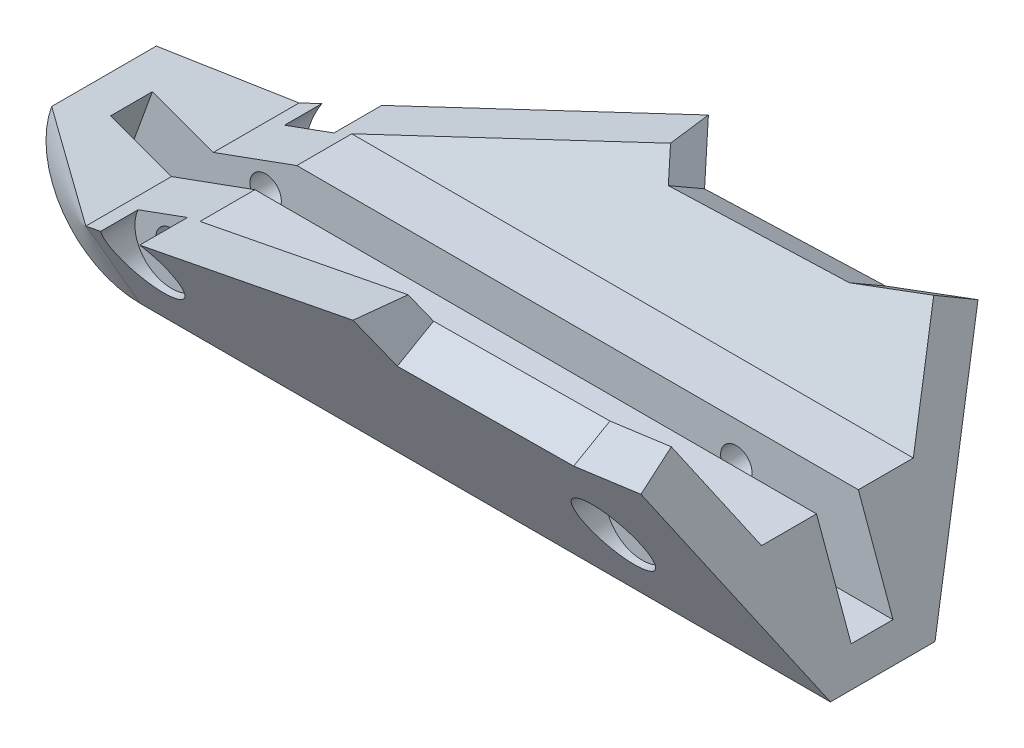
from build123d import *

# Parameters (mm, degrees)
EXTRUDE_1_DEPTH          = 66
CUT_EXTRUDE_1_DEPTH      = 66
CUT_EXTRUDE_1_DEPTH_BACK = 66
SKETCH_2_R               = 1.5
SKETCH_4_R               = 3.5
CUT_EXTRUDE_2_DEPTH      = 5
CUT_EXTRUDE_3_DEPTH      = 66
REVOLVE_1_ANGLE          = 110
SKETCH_7_W               = 6.196152423
SKETCH_7_H               = 4
CUT_EXTRUDE_4_DEPTH      = 66


with BuildPart() as part:
    # 草图1 → 凸台-拉伸1 (new body)
    with BuildSketch(Plane(origin=(0, 0, 0), x_dir=(0, 0, -1), z_dir=(1, 0, 0))):
        Polygon((5, 0), (-5, 0), (-25, 34.641016151), (-21.535898385, 36.641016151), (-7.25388745, 11.903847577), (-2, 11.903847577), (-2, 2.803847577), (2, 2.803847577), (2, 11.903847577), (7.25388745, 11.903847577), (21.535898385, 36.641016151), (25, 34.641016151), align=None)
    extrude(amount=EXTRUDE_1_DEPTH)

    # 草图2 → 切除-拉伸1 (cut, two sides: drawn at the far end of the back side and taken through both)
    with BuildSketch(Plane.XY.offset(-CUT_EXTRUDE_1_DEPTH_BACK)):
        with Locations(Location((5, 8.23, 0), (0, 0, 180))):
            Circle(SKETCH_2_R)
        with Locations(Location((50, 8.23, 0), (0, 0, 180))):
            Circle(SKETCH_2_R)
        Polygon((0, 9), (0, 36.641016151), (75.943067727, 36.641016151), (66, 33.022035462), (66, 0), (55.386922379, 29.159191114), align=None)
    extrude(amount=CUT_EXTRUDE_1_DEPTH + CUT_EXTRUDE_1_DEPTH_BACK, mode=Mode.SUBTRACT)

    # 草图4 → 切除-拉伸2 (cut)
    with BuildSketch(Plane(origin=(0, 0, 12), x_dir=(-1, 0, 0), z_dir=(0, 0, -1))):
        with Locations((-5, 8.23)):
            Circle(SKETCH_4_R)
        with Locations(Location((-50, 8.23, 0), (0, 0, 90))):
            Circle(SKETCH_4_R)
    cut_extrude_2 = extrude(amount=CUT_EXTRUDE_2_DEPTH, mode=Mode.SUBTRACT)

    # 镜向1: 切除-拉伸2 across plane
    add(cut_extrude_2.mirror(Plane.XY), mode=Mode.SUBTRACT)

    # 草图5 → 切除-拉伸3 (cut)
    with BuildSketch(Plane(origin=(0, -2.165063509, 3.75), x_dir=(1, 0, 0), z_dir=(0, -0.5000000000000011, 0.8660254037844382))):
        Polygon((32.339646553, 26.483902367), (34.276892815, 21.874447202), (51.364505918, 22.320217945), (58.994441321, 24.725230573), (55.386922379, 36.170133678), align=None)
    cut_extrude_3 = extrude(amount=-CUT_EXTRUDE_3_DEPTH, mode=Mode.SUBTRACT)

    # 镜向2: 切除-拉伸3 across plane
    add(cut_extrude_3.mirror(Plane.XY), mode=Mode.SUBTRACT)

    # 草图6 → 旋转1 (revolve)
    with BuildSketch(Plane.ZY):
        Polygon((-10.196152423, 9), (-2, 9), (-2, 2.803847577), (2, 2.803847577), (2, 9), (10.196152423, 9), (5, 0), (-5, 0), align=None)
    revolve(axis=Axis((0, 9, -10.196152423), (0, 0, -1)), revolution_arc=REVOLVE_1_ANGLE)

    # 草图7 → 切除-拉伸4 (cut)
    with BuildSketch(Plane(origin=(2.892544244, 7.947199994, 0), x_dir=(0.939692620785907, -0.34202014332567265, 0), z_dir=(0.34202014332567265, 0.939692620785907, 0))):
        with Locations((-6.176257502, 0)):
            Rectangle(SKETCH_7_W, SKETCH_7_H)
    extrude(amount=-CUT_EXTRUDE_4_DEPTH, mode=Mode.SUBTRACT)


solid = part.part
